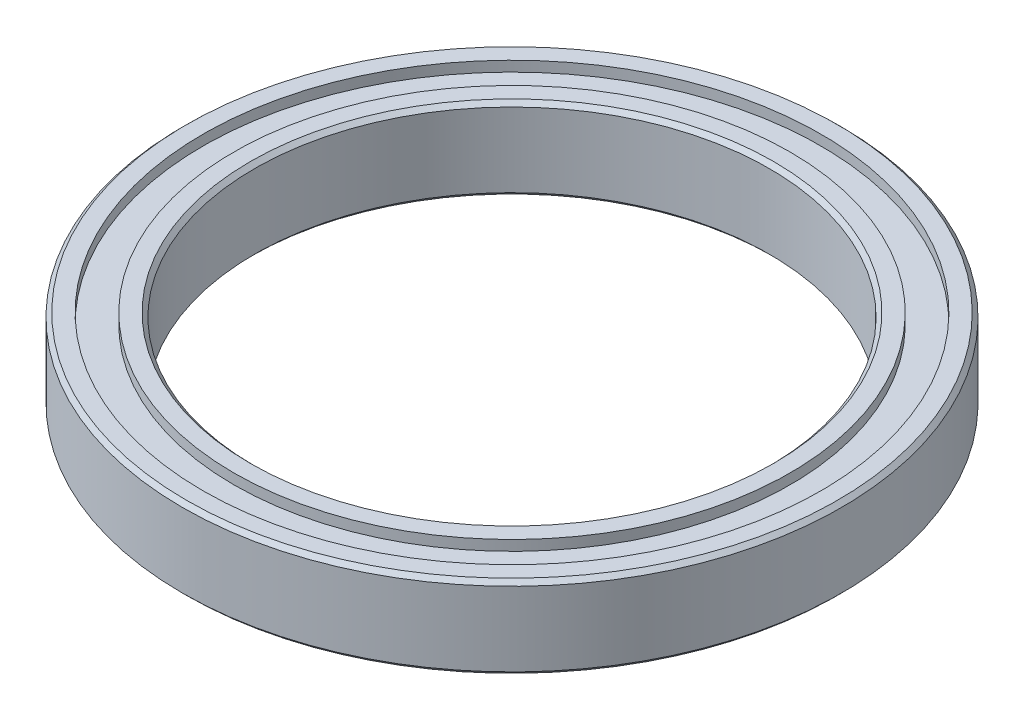
from build123d import *

# Parameters (mm, degrees)
SKETCH_1_R          = 16
SKETCH_1_R_2        = 12.5
EXTRUDE_1_DEPTH     = 4
CHAMFER_1_SIZE      = 0.2
SKETCH_2_R          = 15
SKETCH_2_R_2        = 13.5
CUT_EXTRUDE_1_DEPTH = 0.5
CUT_EXTRUDE_START   = -0.5
SKETCH_3_R          = 15
SKETCH_3_R_2        = 13.5
CUT_EXTRUDE_2_DEPTH = 0.5


with BuildPart() as part:
    # 草图1 → 凸台-拉伸1 (new body)
    with BuildSketch(Plane(origin=(0, 0, 0), x_dir=(1, 0, 0), z_dir=(0, 1, 0))):
        with Locations(Location((0, 0, 0), (0, 0, 270))):
            Circle(SKETCH_1_R)
        with Locations(Location((0, 0, 0), (0, 0, 270))):
            Circle(SKETCH_1_R_2, mode=Mode.SUBTRACT)
    extrude(amount=EXTRUDE_1_DEPTH)

    # 倒角1
    chamfer_1_edges = [part.edges().sort_by_distance(p)[0] for p in [
        (0, 0, -16),
        (0, 4, -16),
        (0, 0, -12.5),
        (0, 4, -12.5),
    ]]
    chamfer(chamfer_1_edges, length=CHAMFER_1_SIZE)

    # 草图2 → 切除-拉伸1 (cut)
    with BuildSketch(Plane(origin=(0, 4, 0), x_dir=(1, 0, 0), z_dir=(0, 1, 0))):
        with Locations(Location((0, 0, 0), (0, 0, 270))):
            Circle(SKETCH_2_R)
        with Locations(Location((0, 0, 0), (0, 0, 270))):
            Circle(SKETCH_2_R_2, mode=Mode.SUBTRACT)
    extrude(amount=-CUT_EXTRUDE_1_DEPTH, mode=Mode.SUBTRACT)

    # 草图3 → 切除-拉伸2 (cut)
    with BuildSketch(Plane.XZ.offset(CUT_EXTRUDE_START)):
        with Locations(Location((0, 0, 0), (0, 0, 90))):
            Circle(SKETCH_3_R)
        with Locations(Location((0, 0, 0), (0, 0, 90))):
            Circle(SKETCH_3_R_2, mode=Mode.SUBTRACT)
    extrude(amount=CUT_EXTRUDE_2_DEPTH, mode=Mode.SUBTRACT)


solid = part.part
